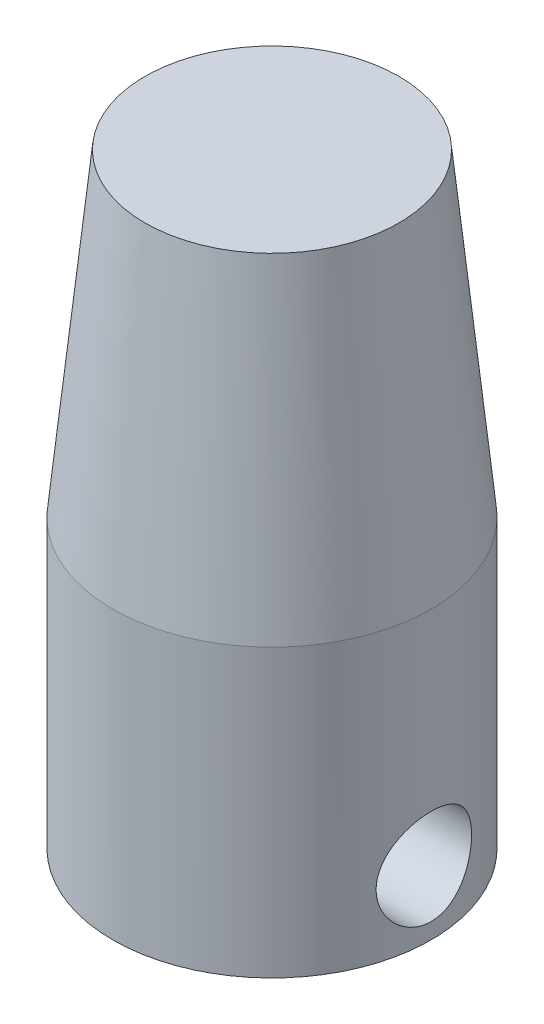
from build123d import *

# Parameters (mm, degrees)
SKETCH1_R             = 5
BODY_DEPTH            = 9
PIN_INSERT_DEPTH      = 12.445523142
PIN_INSERT_DEPTH_BACK = 12.445523142
SKETCH2_R             = 1.5
HEAD_SA_R             = 3.989


with BuildPart() as part:
    # Sketch1 → body (new body)
    with BuildSketch(Plane(origin=(0, 0, 0), x_dir=(1, 0, 0), z_dir=(0, 1, 0))):
        with Locations(Location((0, 0, 0), (0, 0, 270))):
            Circle(SKETCH1_R)
    extrude(amount=BODY_DEPTH)

    # Sketch2 → pin insert (cut, two sides: drawn at the far end of the back side and taken through both)
    with BuildSketch(Plane(origin=(0, 0, 0), x_dir=(0, 0, -1), z_dir=(1, 0, 0)).offset(-PIN_INSERT_DEPTH_BACK)):
        with Locations((0, 2)):
            Circle(SKETCH2_R)
    extrude(amount=PIN_INSERT_DEPTH + PIN_INSERT_DEPTH_BACK, mode=Mode.SUBTRACT)

    # head SA → section 0 of cone
    with BuildSketch(Plane(origin=(0, 19, 0), x_dir=(1, 0, 0), z_dir=(0, 1, 0)), mode=Mode.PRIVATE) as cone_s0:
        Circle(HEAD_SA_R)
    # loft up to a face of the part (cone)
    loft([cone_s0.sketch, part.faces().sort_by_distance((0, 9, 0))[0]])


solid = part.part
